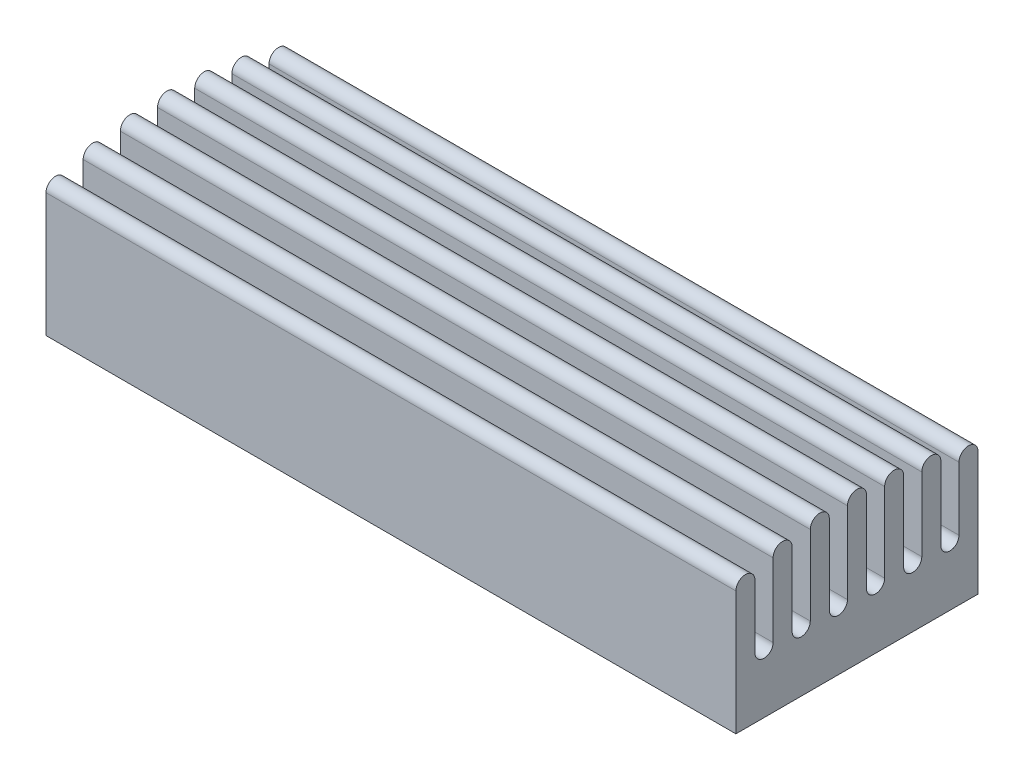
from build123d import *

# Parameters (mm, degrees)
SKETCH2_W           = 57
SKETCH2_H           = 20
BOSS_EXTRUDE1_DEPTH = 12.5
CUT_EXTRUDE1_DEPTH  = 57


with BuildPart() as part:
    # Sketch2 → Boss-Extrude1 (new body)
    with BuildSketch(Plane(origin=(0, 0, 0), x_dir=(1, 0, 0), z_dir=(0, 1, 0))):
        Rectangle(SKETCH2_W, SKETCH2_H)
    extrude(amount=BOSS_EXTRUDE1_DEPTH)

    # Sketch3 → Cut-Extrude1 (cut)
    with BuildSketch(Plane(origin=(28.5, 0, 0), x_dir=(0, 0, -1), z_dir=(1, 0, 0))):
        with BuildLine():
            Line((-10, 12.5), (-10, 10.22312083))
            ThreePointArc((-10, 10.22312083), (-9.214285714, 11.008835116), (-8.428571429, 10.22312083))
            Line((-8.428571429, 10.22312083), (-8.428571429, 5))
            ThreePointArc((-8.428571429, 5), (-7.678571429, 4.25), (-6.928571429, 5))
            Line((-6.928571429, 5), (-6.928571429, 11.061158869))
            ThreePointArc((-6.928571429, 11.061158869), (-6.142857143, 11.846873154), (-5.357142857, 11.061158869))
            Line((-5.357142857, 11.061158869), (-5.357142857, 5))
            ThreePointArc((-5.357142857, 5), (-4.607142857, 4.25), (-3.857142857, 5))
            Line((-3.857142857, 5), (-3.857142857, 11.552380562))
            ThreePointArc((-3.857142857, 11.552380562), (-3.071428571, 12.338094848), (-2.285714286, 11.552380562))
            Line((-2.285714286, 11.552380562), (-2.285714286, 5))
            ThreePointArc((-2.285714286, 5), (-1.535714286, 4.25), (-0.785714286, 5))
            Line((-0.785714286, 5), (-0.785714286, 11.714285714))
            ThreePointArc((-0.785714286, 11.714285714), (-0.5555839, 12.269869614), (0, 12.5))
            Line((0, 12.5), (-10, 12.5))
        make_face()
    cut_extrude1 = extrude(amount=-CUT_EXTRUDE1_DEPTH, mode=Mode.SUBTRACT)

    # Mirror1: Cut-Extrude1 across plane
    add(cut_extrude1.mirror(Plane.XY), mode=Mode.SUBTRACT)


solid = part.part
